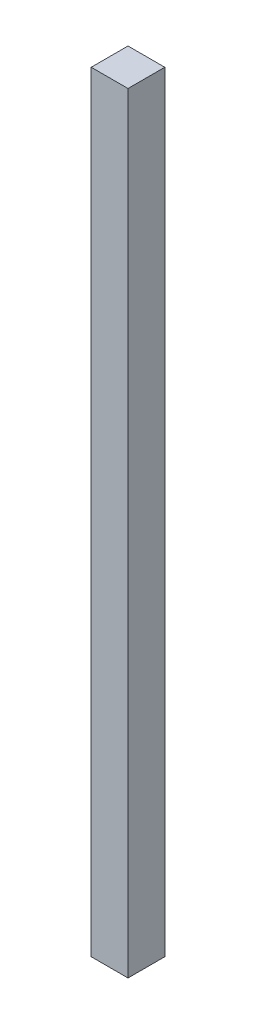
from build123d import *

# Parameters (mm, degrees)
SKETCH1_W           = 88.9
SKETCH1_H           = 88.9
BOSS_EXTRUDE1_DEPTH = 930.671875


with BuildPart() as part:
    # Sketch1 → Boss-Extrude1 (new, symmetric)
    with BuildSketch(Plane(origin=(0, 0, 0), x_dir=(1, 0, 0), z_dir=(0, 1, 0))):
        Rectangle(SKETCH1_W, SKETCH1_H)
    extrude(amount=BOSS_EXTRUDE1_DEPTH, both=True)


solid = part.part
